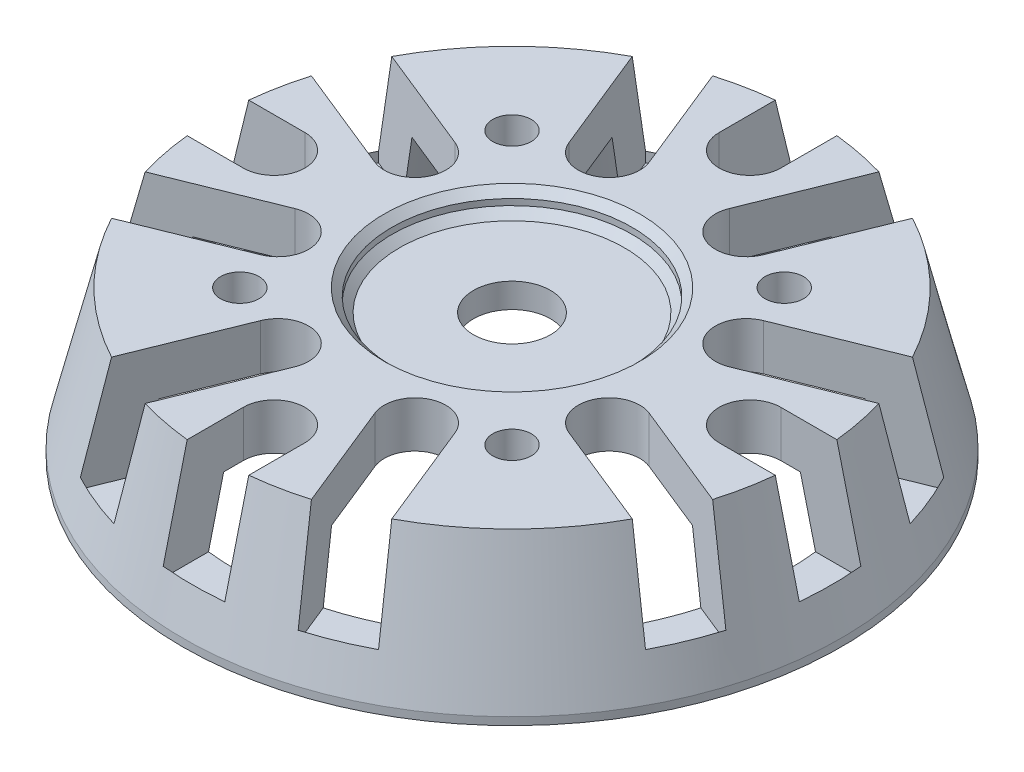
from build123d import *

# Parameters (mm, degrees)
SKETCH_1_R           = 21.4
EXTRUDE_2_DEPTH      = 0.5
SKETCH_6_R           = 19.2
SHELL_1_T            = -3
SKETCH_7_R           = 2.5
CUT_EXTRUDE_1_DEPTH  = 32.720182984
SKETCH_8_R           = 7.8
CUT_EXTRUDE_2_DEPTH  = 1.4
CHAMFER_1_SIZE       = 0.5
CUT_EXTRUDE_11_DEPTH = 7
HOLE_WIZARD_M3_1_D   = 2.5


with BuildPart() as part:
    # 草图1 → 凸台-拉伸2 (new body)
    with BuildSketch(Plane(origin=(0, 0, 0), x_dir=(1, 0, 0), z_dir=(0, 1, 0))):
        with Locations(Location((0, 0, 0), (0, 0, 270))):
            Circle(SKETCH_1_R)
    extrude(amount=EXTRUDE_2_DEPTH)

    # 草图6 → section 0 of loft_1
    with BuildSketch(Plane(origin=(0, 9.5, 0), x_dir=(1, 0, 0), z_dir=(0, 1, 0)), mode=Mode.PRIVATE) as loft_1_s0:
        Circle(SKETCH_6_R)
    # loft up to a face of the part (loft_1)
    loft([loft_1_s0.sketch, part.faces().sort_by_distance((0, 0.5, 0))[0]])

    # 抽壳1
    shell_1_openings = [part.faces().sort_by_distance(p)[0] for p in [
        (0, 0, 0),
    ]]
    offset(amount=SHELL_1_T, openings=shell_1_openings)

    # 草图7 → 切除-拉伸1 (cut, through all)
    with BuildSketch(Plane(origin=(0, 9.5, 0), x_dir=(1, 0, 0), z_dir=(0, 1, 0))):
        with Locations(Location((0, 0, 0), (0, 0, 270))):
            Circle(SKETCH_7_R)
    extrude(amount=-CUT_EXTRUDE_1_DEPTH, mode=Mode.SUBTRACT)

    # 草图8 → 切除-拉伸2 (cut)
    with BuildSketch(Plane(origin=(0, 9.5, 0), x_dir=(1, 0, 0), z_dir=(0, 1, 0))):
        with Locations(Location((0, 0, 0), (0, 0, 270))):
            Circle(SKETCH_8_R)
    extrude(amount=-CUT_EXTRUDE_2_DEPTH, mode=Mode.SUBTRACT)

    # 倒角1
    chamfer_1_edges = [part.edges().sort_by_distance(p)[0] for p in [
        (0, 9.5, -7.8),
        (0, 8.1, -7.8),
    ]]
    chamfer(chamfer_1_edges, length=CHAMFER_1_SIZE)

    # 草图9 → 切除-拉伸11 (cut)
    with BuildSketch(Plane(origin=(0, 9.5, 0), x_dir=(1, 0, 0), z_dir=(0, 1, 0))):
        with BuildLine():
            Line((-2, 15.451390353), (-2, 20.653389552))
            ThreePointArc((-2, 20.653389552), (0, 20.75), (2, 20.653389552))
            Line((2, 20.653389552), (2, 15.451390353))
            ThreePointArc((2, 15.451390353), (0, 13.451390353), (-2, 15.451390353))
        make_face()
        with BuildLine():
            Line((2.601690797, 11.507097509), (5.981760612, 19.869097614))
            ThreePointArc((5.981760612, 19.869097614), (7.869025388, 19.200024465), (9.683013266, 18.352159385))
            Line((9.683013266, 18.352159385), (6.310179323, 10.008060201))
            ThreePointArc((6.310179323, 10.008060201), (3.706416406, 8.903334592), (2.601690797, 11.507097509))
        make_face()
        with BuildLine():
            Line((-2.601690797, 11.507097509), (-5.981760612, 19.869097614))
            ThreePointArc((-5.981760612, 19.869097614), (-7.869025388, 19.200024465), (-9.683013266, 18.352159385))
            Line((-9.683013266, 18.352159385), (-6.310179323, 10.008060201))
            ThreePointArc((-6.310179323, 10.008060201), (-3.706416406, 8.903334592), (-2.601690797, 11.507097509))
        make_face()
        with BuildLine():
            Line((15.451390353, 2), (20.653389552, 2))
            ThreePointArc((20.653389552, 2), (20.75, 0), (20.653389552, -2))
            Line((20.653389552, -2), (15.451390353, -2))
            ThreePointArc((15.451390353, -2), (13.451390353, 0), (15.451390353, 2))
        make_face()
        with BuildLine():
            Line((11.507097509, 2.601690797), (19.869097614, 5.981760612))
            ThreePointArc((19.869097614, 5.981760612), (19.200024465, 7.869025388), (18.352159385, 9.683013266))
            Line((18.352159385, 9.683013266), (10.008060201, 6.310179323))
            ThreePointArc((10.008060201, 6.310179323), (8.903334592, 3.706416406), (11.507097509, 2.601690797))
        make_face()
        with BuildLine():
            Line((11.507097509, -2.601690797), (19.869097614, -5.981760612))
            ThreePointArc((19.869097614, -5.981760612), (19.200024465, -7.869025388), (18.352159385, -9.683013266))
            Line((18.352159385, -9.683013266), (10.008060201, -6.310179323))
            ThreePointArc((10.008060201, -6.310179323), (8.903334592, -3.706416406), (11.507097509, -2.601690797))
        make_face()
        with BuildLine():
            Line((2, -15.451390353), (2, -20.653389552))
            ThreePointArc((2, -20.653389552), (0, -20.75), (-2, -20.653389552))
            Line((-2, -20.653389552), (-2, -15.451390353))
            ThreePointArc((-2, -15.451390353), (0, -13.451390353), (2, -15.451390353))
        make_face()
        with BuildLine():
            Line((2.601690797, -11.507097509), (5.981760612, -19.869097614))
            ThreePointArc((5.981760612, -19.869097614), (7.869025388, -19.200024465), (9.683013266, -18.352159385))
            Line((9.683013266, -18.352159385), (6.310179323, -10.008060201))
            ThreePointArc((6.310179323, -10.008060201), (3.706416406, -8.903334592), (2.601690797, -11.507097509))
        make_face()
        with BuildLine():
            Line((-2.601690797, -11.507097509), (-5.981760612, -19.869097614))
            ThreePointArc((-5.981760612, -19.869097614), (-7.869025388, -19.200024465), (-9.683013266, -18.352159385))
            Line((-9.683013266, -18.352159385), (-6.310179323, -10.008060201))
            ThreePointArc((-6.310179323, -10.008060201), (-3.706416406, -8.903334592), (-2.601690797, -11.507097509))
        make_face()
        with BuildLine():
            Line((-15.451390353, -2), (-20.653389552, -2))
            ThreePointArc((-20.653389552, -2), (-20.75, 0), (-20.653389552, 2))
            Line((-20.653389552, 2), (-15.451390353, 2))
            ThreePointArc((-15.451390353, 2), (-13.451390353, 0), (-15.451390353, -2))
        make_face()
        with BuildLine():
            Line((-11.507097509, -2.601690797), (-19.869097614, -5.981760612))
            ThreePointArc((-19.869097614, -5.981760612), (-19.200024465, -7.869025388), (-18.352159385, -9.683013266))
            Line((-18.352159385, -9.683013266), (-10.008060201, -6.310179323))
            ThreePointArc((-10.008060201, -6.310179323), (-8.903334592, -3.706416406), (-11.507097509, -2.601690797))
        make_face()
        with BuildLine():
            Line((-11.507097509, 2.601690797), (-19.869097614, 5.981760612))
            ThreePointArc((-19.869097614, 5.981760612), (-19.200024465, 7.869025388), (-18.352159385, 9.683013266))
            Line((-18.352159385, 9.683013266), (-10.008060201, 6.310179323))
            ThreePointArc((-10.008060201, 6.310179323), (-8.903334592, 3.706416406), (-11.507097509, 2.601690797))
        make_face()
    extrude(amount=-CUT_EXTRUDE_11_DEPTH, mode=Mode.SUBTRACT)

    # M3 螺纹孔的螺纹孔钻头1 (through all)
    with Locations(Plane(origin=(-8.838834765, 9.5, 8.838834765), x_dir=(0, 0, 1), z_dir=(0, 1, 0))):
        with Locations((0, 0), (0, 17.67766953), (-17.67766953, 17.67766953), (-17.67766953, 0)):
            Hole(HOLE_WIZARD_M3_1_D / 2)


solid = part.part
